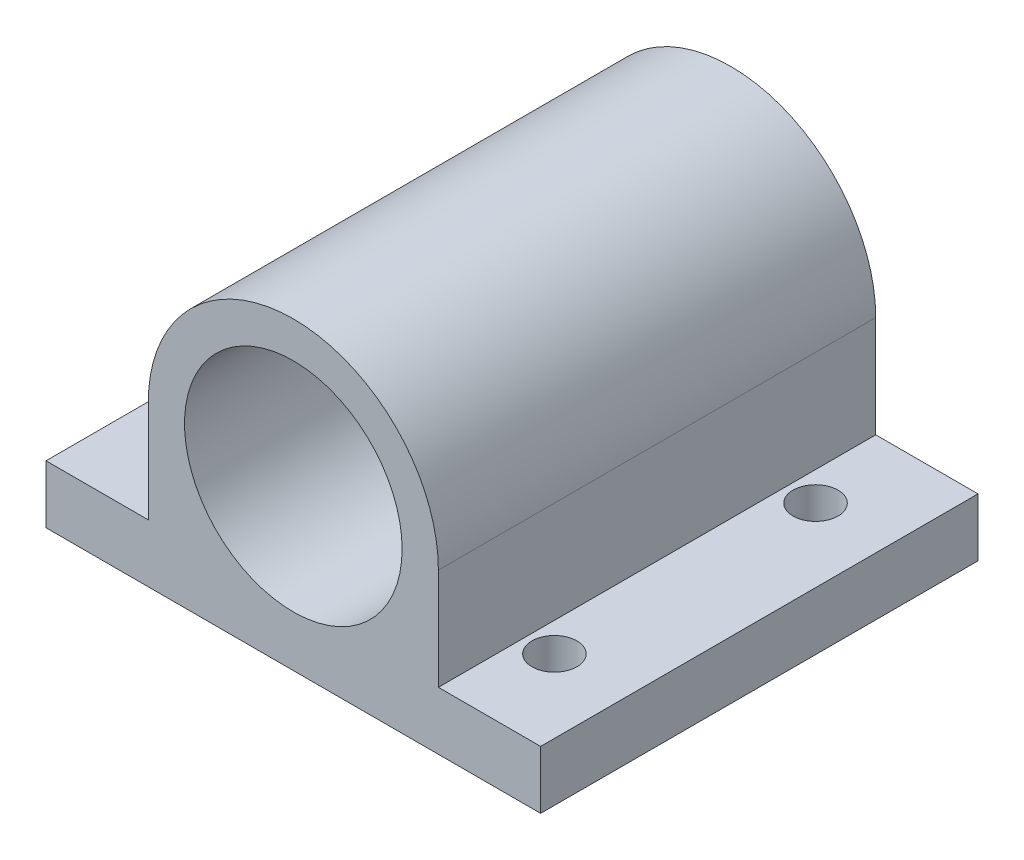
from build123d import *

# Parameters (mm, degrees)
SKETCH1_R           = 7.5
BOSS_EXTRUDE1_DEPTH = 30.15
SKETCH2_R           = 1.55
CUT_EXTRUDE1_DEPTH  = 30.15


with BuildPart() as part:
    # Sketch1 → Boss-Extrude1 (new body)
    with BuildSketch(Plane.XY):
        with BuildLine():
            Line((0, 0), (-34.1, 0))
            Line((-34.1, 0), (-34.1, 4))
            Line((-34.1, 4), (-27.05, 4))
            Line((-27.05, 4), (-27.05, 11))
            ThreePointArc((-27.05, 11), (-17.05, 21), (-7.05, 11))
            Line((-7.05, 11), (-7.05, 4))
            Line((-7.05, 4), (0, 4))
            Line((0, 4), (0, 0))
        make_face()
        with Locations((-17.05, 11)):
            Circle(SKETCH1_R, mode=Mode.SUBTRACT)
    extrude(amount=-BOSS_EXTRUDE1_DEPTH)

    # Sketch2 → Cut-Extrude1 (cut)
    with BuildSketch(Plane(origin=(0, 0, 0), x_dir=(-1, 0, 0), z_dir=(0, -1, 0))):
        with Locations(Location((29.05, 6, 0), (0, 0, 180))):
            Circle(SKETCH2_R)
        with Locations(Location((29.05, 24, 0), (0, 0, 180))):
            Circle(SKETCH2_R)
        with Locations(Location((5.05, 6, 0), (0, 0, 180))):
            Circle(SKETCH2_R)
        with Locations(Location((5.05, 24, 0), (0, 0, 180))):
            Circle(SKETCH2_R)
    extrude(amount=-CUT_EXTRUDE1_DEPTH, mode=Mode.SUBTRACT)


solid = part.part
